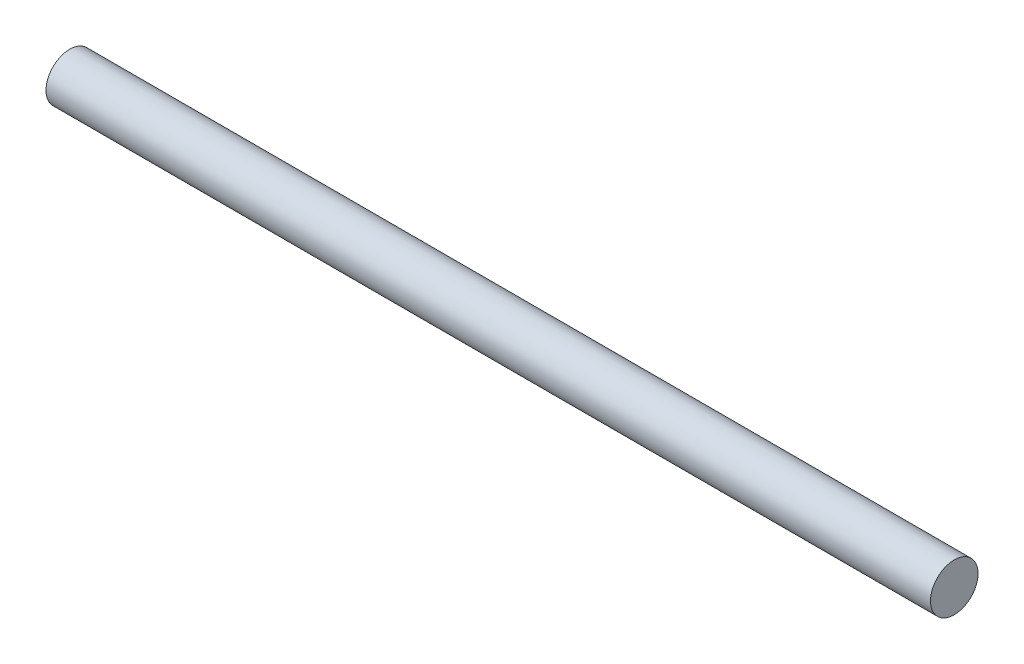
from build123d import *

# Parameters (mm, degrees)
SKETCH1_R           = 2.5
BOSS_EXTRUDE1_DEPTH = 46.5


with BuildPart() as part:
    # Sketch1 → Boss-Extrude1 (new, symmetric)
    with BuildSketch(Plane(origin=(0, 0, 0), x_dir=(0, 0, -1), z_dir=(1, 0, 0))):
        with Locations(Location((0, 0, 0), (0, 0, 180))):
            Circle(SKETCH1_R)
    extrude(amount=BOSS_EXTRUDE1_DEPTH, both=True)


solid = part.part
